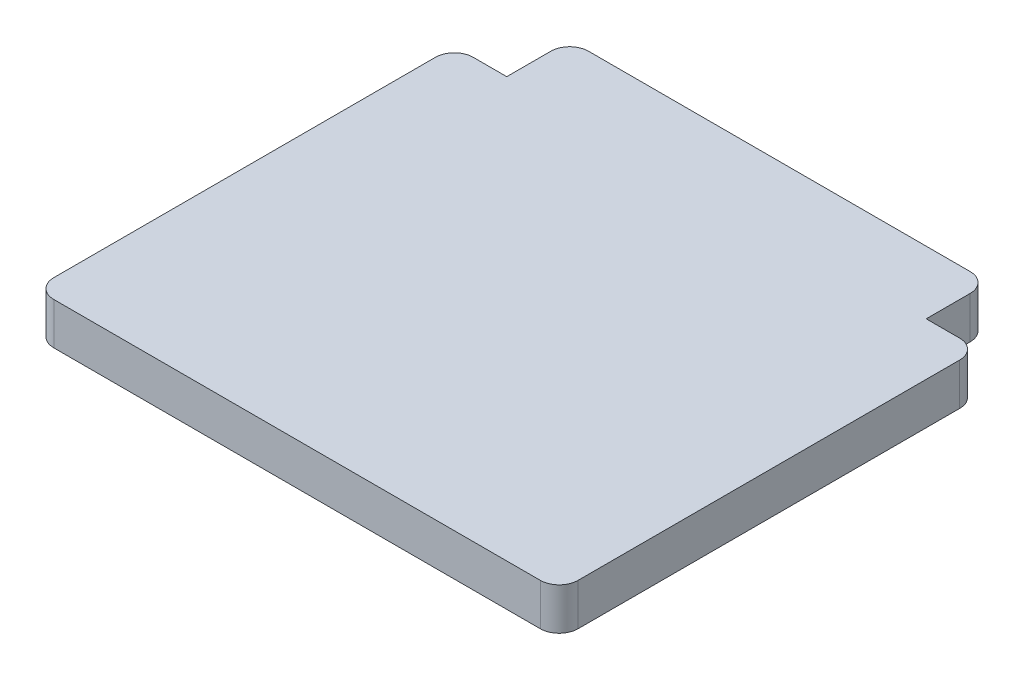
from build123d import *

# Parameters (mm, degrees)
ESBO_O1_W                = 20
ESBO_O1_H                = 3
RESSALTO_EXTRUS_O1_DEPTH = 2


with BuildPart() as part:
    # Esboço1 → Ressalto-extrusão1 (new body)
    with BuildSketch(Plane(origin=(0, 0, 0), x_dir=(1, 0, 0), z_dir=(0, 1, 0))):
        with BuildLine():
            Line((-10, 10), (-11.599758025, 10))
            ThreePointArc((-11.599758025, 10), (-12.23632523, 9.73632523), (-12.5, 9.099758025))
            Line((-12.5, 9.099758025), (-12.5, -9.099758025))
            ThreePointArc((-12.5, -9.099758025), (-12.23632523, -9.73632523), (-11.599758025, -10))
            Line((-11.599758025, -10), (11.599758025, -10))
            ThreePointArc((11.599758025, -10), (12.23632523, -9.73632523), (12.5, -9.099758025))
            Line((12.5, -9.099758025), (12.5, 9.099758025))
            ThreePointArc((12.5, 9.099758025), (12.23632523, 9.73632523), (11.599758025, 10))
            Line((11.599758025, 10), (10, 10))
            Line((10, 10), (10, 7))
            Line((10, 7), (-10, 7))
            Line((-10, 7), (-10, 10))
        make_face()
        with BuildLine():
            Line((-10, 12.099758025), (-10, 10))
            Line((-10, 10), (10, 10))
            Line((10, 10), (10, 12.099758025))
            ThreePointArc((10, 12.099758025), (9.73632523, 12.73632523), (9.099758025, 13))
            Line((9.099758025, 13), (-9.099758025, 13))
            ThreePointArc((-9.099758025, 13), (-9.73632523, 12.73632523), (-10, 12.099758025))
        make_face()
        with Locations((0, 8.5)):
            Rectangle(ESBO_O1_W, ESBO_O1_H)
    extrude(amount=RESSALTO_EXTRUS_O1_DEPTH)


solid = part.part
